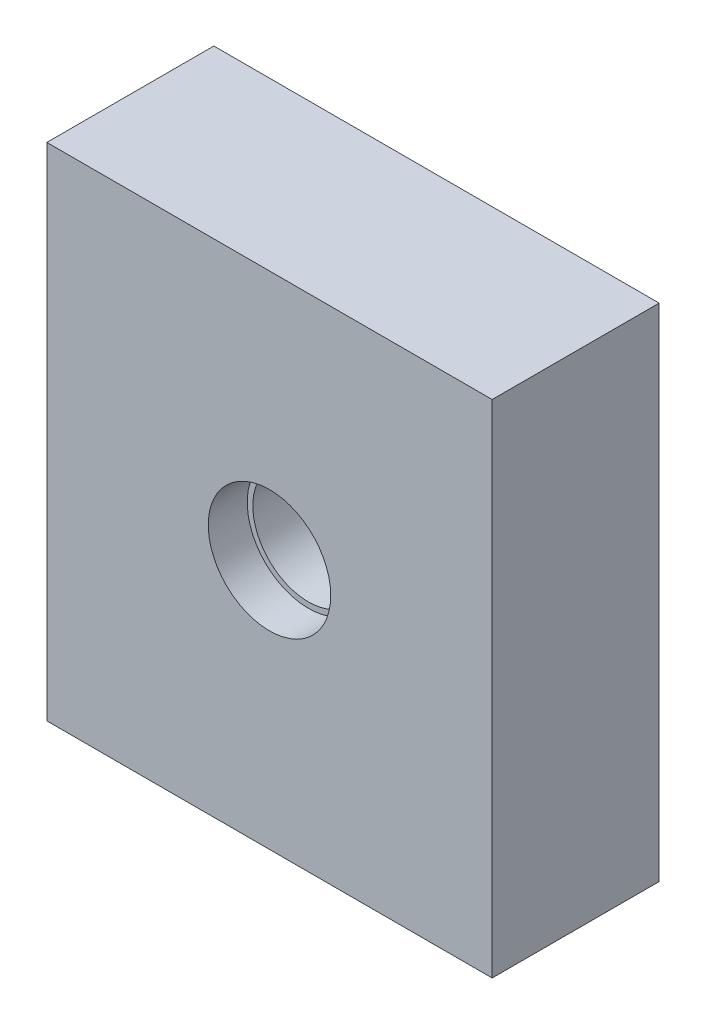
from build123d import *

# Parameters (mm, degrees)
SKETCH1_W                      = 80
SKETCH1_H                      = 90
BOSS_EXTRUDE1_DEPTH            = 30
F_2_5_2_5_DIAMETER_HOLE1_D     = 2.5
F_2_5_2_5_DIAMETER_HOLE1_DEPTH = 7
F_2_5_2_5_DIAMETER_HOLE1_TIP   = 0.721687836
F_8_0_8_DIAMETER_HOLE1_D       = 8
F_8_0_8_DIAMETER_HOLE1_DEPTH   = 10
F_8_0_8_DIAMETER_HOLE1_TIP     = 2.309401077


with BuildPart() as part:
    # Sketch1 → Boss-Extrude1 (new body)
    with BuildSketch(Plane(origin=(0, 0, 0), x_dir=(-1, 0, 0), z_dir=(0, 0, -1))):
        with Locations((-40, 45)):
            Rectangle(SKETCH1_W, SKETCH1_H)
    extrude(amount=-BOSS_EXTRUDE1_DEPTH)

    # Sketch2 → Cut-Revolve1 (revolve, cut)
    with BuildSketch(Plane(origin=(0, 45, 0), x_dir=(-1, 0, 0), z_dir=(0, -1, 0)), mode=Mode.PRIVATE) as cut_revolve1_sk:
        Polygon((-29, 0), (-40, 0), (-40, -30), (-29, -30), (-29, -23), (-30, -23), (-30, -8), (-29, -8), align=None)
    revolve(cut_revolve1_sk.sketch.rotate(Axis((40, 45, 0), (0, 0, 1)), 180), axis=Axis((40, 45, 0), (0, 0, 1)), mode=Mode.SUBTRACT)

    # Ø2.5 (2.5) Diameter Hole1
    with Locations(Plane(origin=(0, 0, 0), x_dir=(-1, 0, 0), z_dir=(0, 0, -1))):
        with Locations((-26.75, 63.799933511), (-53.25, 26.200066489)):
            Hole(F_2_5_2_5_DIAMETER_HOLE1_D / 2, depth=F_2_5_2_5_DIAMETER_HOLE1_DEPTH)
            with Locations((0, 0, -(F_2_5_2_5_DIAMETER_HOLE1_DEPTH + F_2_5_2_5_DIAMETER_HOLE1_TIP / 2))):  # 120° drill point
                Cone(0, F_2_5_2_5_DIAMETER_HOLE1_D / 2, F_2_5_2_5_DIAMETER_HOLE1_TIP, mode=Mode.SUBTRACT)

    # Ø8.0 (8) Diameter Hole1
    with Locations(Plane(origin=(0, 0, 0), x_dir=(-1, 0, 0), z_dir=(0, 0, -1))):
        with Locations((-30, 10), (-30, 80), (-65, 10), (-65, 80)):
            Hole(F_8_0_8_DIAMETER_HOLE1_D / 2, depth=F_8_0_8_DIAMETER_HOLE1_DEPTH)
            with Locations((0, 0, -(F_8_0_8_DIAMETER_HOLE1_DEPTH + F_8_0_8_DIAMETER_HOLE1_TIP / 2))):  # 120° drill point
                Cone(0, F_8_0_8_DIAMETER_HOLE1_D / 2, F_8_0_8_DIAMETER_HOLE1_TIP, mode=Mode.SUBTRACT)


solid = part.part
